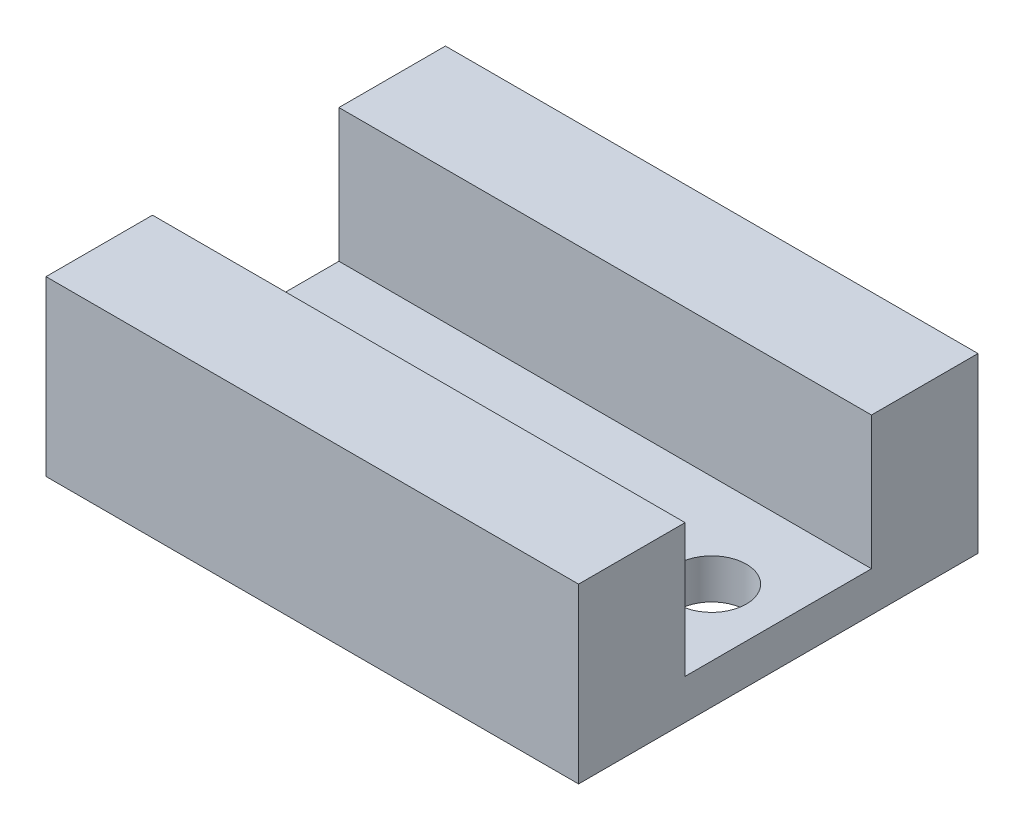
from build123d import *

# Parameters (mm, degrees)
SKETCH_1_W      = 20
SKETCH_1_H      = 15
SKETCH_1_R      = 1.3
EXTRUDE_1_DEPTH = 1.5
SKETCH_2_W      = 20
SKETCH_2_H      = 4
EXTRUDE_2_DEPTH = 5


with BuildPart() as part:
    # 草图1 → 凸台-拉伸1 (new body)
    with BuildSketch(Plane(origin=(0, 0, 0), x_dir=(1, 0, 0), z_dir=(0, 1, 0))):
        Rectangle(SKETCH_1_W, SKETCH_1_H)
        with Locations(Location((7.5, 0, 0), (0, 0, 270))):
            Circle(SKETCH_1_R, mode=Mode.SUBTRACT)
        with Locations(Location((-7.5, 0, 0), (0, 0, 270))):
            Circle(SKETCH_1_R, mode=Mode.SUBTRACT)
    extrude(amount=EXTRUDE_1_DEPTH)

    # 草图2 → 凸台-拉伸2 (add)
    with BuildSketch(Plane(origin=(0, 1.5, 0), x_dir=(1, 0, 0), z_dir=(0, 1, 0))):
        with Locations((0, 5.5)):
            Rectangle(SKETCH_2_W, SKETCH_2_H)
        with Locations((0, -5.5)):
            Rectangle(SKETCH_2_W, SKETCH_2_H)
    extrude(amount=EXTRUDE_2_DEPTH)


solid = part.part
